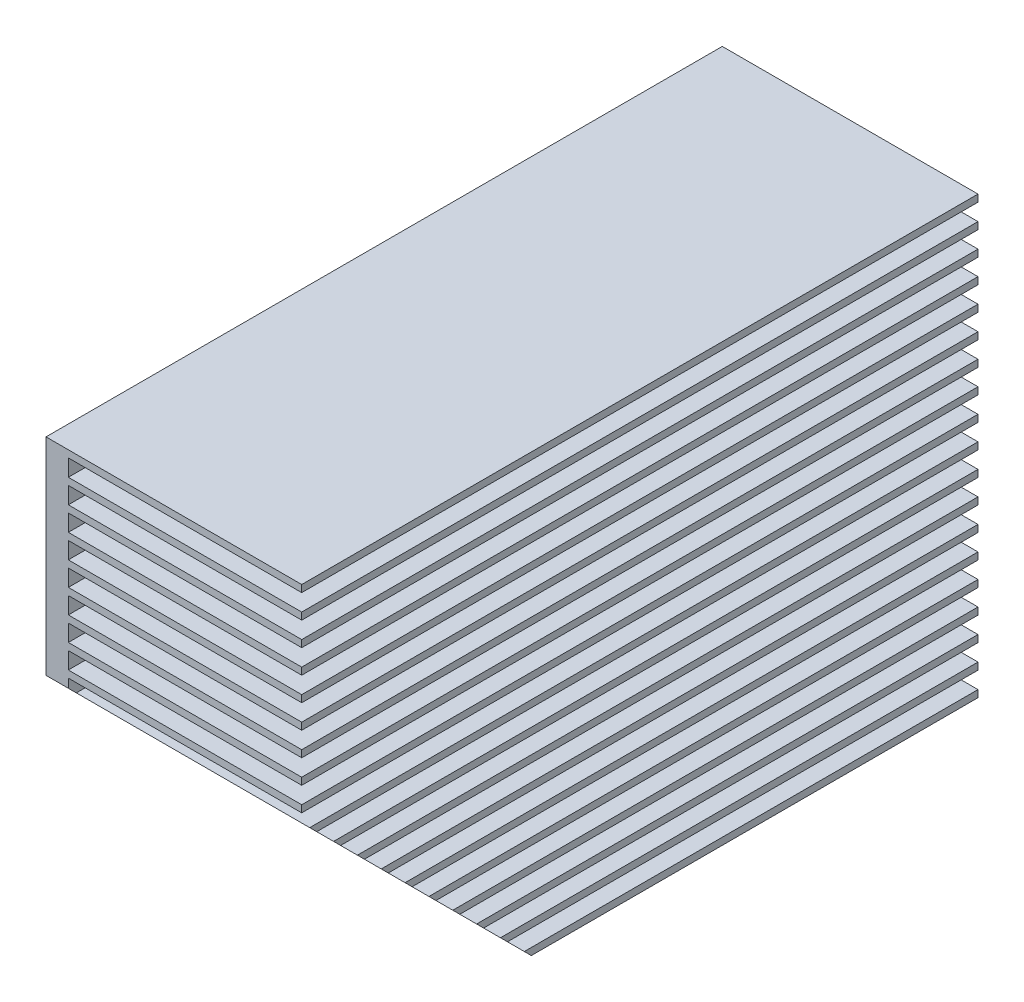
from build123d import *

# Parameters (mm, degrees)
SKETCH1_W               = 96.131545064
SKETCH1_H               = 62
BOSS_EXTRUDE1_DEPTH     = 3.175
SKETCH2_W               = 96.131545064
SKETCH2_H               = 1
EXTRUDE_THIN1_DEPTH     = 33.175
LPATTERN1_COUNT         = 19
LPATTERN1_PITCH         = 3.388888889
CUT_EXTRUDE1_DEPTH      = 67.120338127
CUT_EXTRUDE1_DEPTH_BACK = 67.120338127


with BuildPart() as part:
    # Sketch1 → Boss-Extrude1 (new body)
    with BuildSketch(Plane(origin=(0, 0, 0), x_dir=(0, 0, -1), z_dir=(1, 0, 0))):
        Rectangle(SKETCH1_W, SKETCH1_H)
    extrude(amount=BOSS_EXTRUDE1_DEPTH)

    # Sketch2 → Extrude-Thin1 (add)
    with BuildSketch(Plane(origin=(3.175, 0, 0), x_dir=(0, 0, -1), z_dir=(1, 0, 0))):
        with Locations((0, 30.5)):
            Rectangle(SKETCH2_W, SKETCH2_H)
    extrude_thin1 = extrude(amount=EXTRUDE_THIN1_DEPTH)

    # LPattern1: Extrude-Thin1 ×19
    with Locations(*[(0, -i * LPATTERN1_PITCH, 0) for i in range(1, LPATTERN1_COUNT)]):
        add(extrude_thin1)

    # Sketch3 → Cut-Extrude1 (cut, two sides: drawn at the far end of the back side and taken through both)
    with BuildSketch(Plane(origin=(3.175, 0, 0), x_dir=(0, 0, -1), z_dir=(1, 0, 0)).offset(-CUT_EXTRUDE1_DEPTH_BACK)):
        Polygon((-0.096506061, -46.331819287), (-55.483661094, 9.055335745), (-88.096831181, -23.557834342), (-32.709676149, -78.944989375), align=None)
    extrude(amount=CUT_EXTRUDE1_DEPTH + CUT_EXTRUDE1_DEPTH_BACK, mode=Mode.SUBTRACT)


solid = part.part
